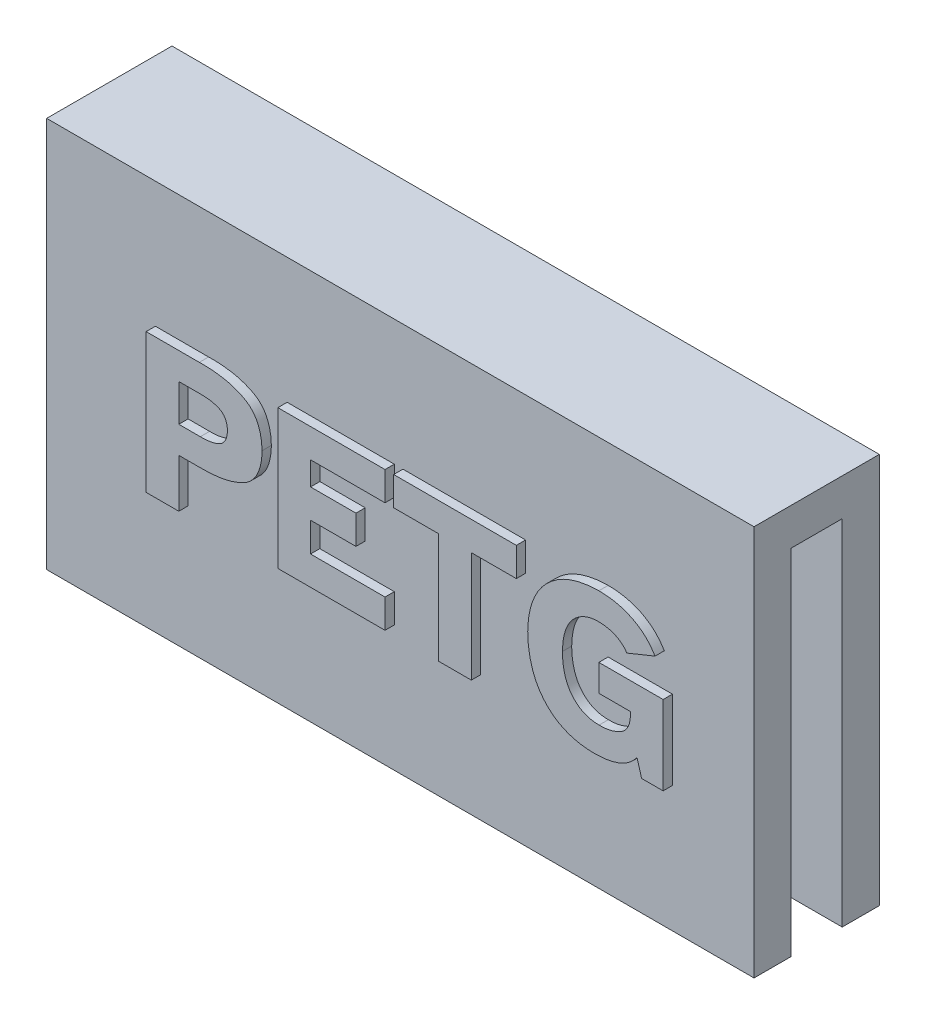
from build123d import *

# Parameters (mm, degrees)
BOSS_EXTRUDE1_DEPTH = 38.1
BOSS_EXTRUDE3_DEPTH = 1


with BuildPart() as part:
    # Sketch1 → Boss-Extrude1 (new, symmetric)
    with BuildSketch(Plane(origin=(0, 0, 0), x_dir=(0, 0, -1), z_dir=(1, 0, 0))):
        Polygon((0, 0), (0, 42.1), (13.5, 42.1), (13.5, 0), (9.5, 0), (9.5, 38.1), (4, 38.1), (4, 0), align=None)
    extrude(amount=BOSS_EXTRUDE1_DEPTH, both=True)

    # Sketch2 → Boss-Extrude3 (add, symmetric)
    # profile 1 of 4: a face of its own
    with BuildSketch(Plane.XY):
        with BuildLine():
            Line((-22.865222246, 13.563040297), (-22.865222246, 18.780432709))
            Line((-22.865222246, 18.780432709), (-20.656196004, 18.780432709))
            add(Edge.make_bspline(
                [(-20.656196004, 18.780432709), (-20.41532138, 18.777714688), (-19.944746821, 18.772404742), (-19.256261279, 18.810224697), (-18.600645479, 18.877020485), (-17.978390446, 18.980226184), (-17.390247833, 19.12055906), (-16.836558282, 19.293424233), (-16.315862603, 19.49892128), (-15.828517725, 19.737297205), (-15.380553204, 20.022617586), (-14.993581031, 20.375797987), (-14.662017368, 20.786709496), (-14.391374272, 21.257071797), (-14.179098793, 21.785516775), (-14.024744286, 22.370402283), (-13.921962582, 23.01285099), (-13.903931965, 23.461547081), (-13.894568167, 23.694567371)],
                knots=[0, 0, 0, 0, 1.204916498, 2.353934341, 3.447552957, 4.50072552, 5.507144687, 6.470335232, 7.400410051, 8.305130608, 9.181490644, 10.047735884, 10.914032333, 11.813195112, 12.752367202, 13.754944245, 14.834080452, 16, 16, 16, 16], degree=3))
            add(Edge.make_bspline(
                [(-13.894568167, 23.694567371), (-13.903912104, 23.925417991), (-13.921898868, 24.369797661), (-14.025029441, 25.006807545), (-14.179399587, 25.587187383), (-14.389513591, 26.111548771), (-14.664177487, 26.574134139), (-14.993451519, 26.981011122), (-15.380818743, 27.330678309), (-15.828590089, 27.612940523), (-16.316667278, 27.84726287), (-16.836506867, 28.053338122), (-17.389829867, 28.226848133), (-17.978554423, 28.363192211), (-18.600944194, 28.462338902), (-19.256226176, 28.530250328), (-19.945228379, 28.567767567), (-20.416269188, 28.562489884), (-20.657613081, 28.559785795)],
                knots=[0, 0, 0, 0, 1.159335541, 2.231681874, 3.232698059, 4.170289135, 5.058653394, 5.923911943, 6.789704034, 7.666336687, 8.571988794, 9.505503644, 10.472256703, 11.481143997, 12.537323696, 13.634987235, 14.788254905, 16, 16, 16, 16], degree=3))
            Line((-20.657613081, 28.559785795), (-26.386965308, 28.563043481))
            Line((-26.386965308, 28.563043481), (-26.386965308, 13.563040297))
            Line((-26.386965308, 13.563040297), (-22.865222246, 13.563040297))
        make_face()
        with BuildLine():
            Line((-22.865222246, 25.667387508), (-20.544629022, 25.667387508))
            add(Edge.make_bspline(
                [(-20.544629022, 25.667387508), (-20.345180429, 25.665639397), (-19.962840192, 25.662288292), (-19.413885258, 25.59887468), (-18.918181922, 25.479214253), (-18.542791264, 25.333863497), (-18.279322093, 25.181576921), (-18.109546209, 25.041861769), (-17.964935401, 24.876369042), (-17.843038449, 24.687071269), (-17.752852301, 24.470987064), (-17.684339378, 24.233628804), (-17.637945851, 23.972355884), (-17.629418881, 23.789333614), (-17.625003742, 23.694567371)],
                knots=[0, 0, 0, 0, 1.781037572, 3.414224772, 4.923837313, 6.326680743, 6.992801752, 7.634335185, 8.281065082, 8.949094245, 9.636325156, 10.36458847, 11.153207937, 12, 12, 12, 12], degree=3))
            add(Edge.make_bspline(
                [(-17.625003742, 23.694567371), (-17.629329654, 23.597614693), (-17.637641958, 23.411318694), (-17.684922478, 23.144843592), (-17.752207557, 22.902812702), (-17.843064613, 22.682637579), (-17.964858791, 22.490072062), (-18.109429188, 22.321339009), (-18.279109983, 22.1782603), (-18.542470117, 22.021767063), (-18.917168662, 21.869595463), (-19.414049866, 21.749447311), (-19.962950296, 21.674835955), (-20.346487469, 21.675658964), (-20.546743492, 21.676088682)],
                knots=[0, 0, 0, 0, 0.858904102, 1.650396881, 2.391060107, 3.081381858, 3.751946835, 4.400513148, 5.042831016, 5.70833034, 7.106722173, 8.605996457, 10.227891054, 12, 12, 12, 12], degree=3))
            Line((-20.546743492, 21.676088682), (-22.865222246, 21.676088682))
            Line((-22.865222246, 21.676088682), (-22.865222246, 25.667387508))
        make_face(mode=Mode.SUBTRACT)
    # profile 2 of 4: a face of its own
    with BuildSketch(Plane.XY):
        Polygon((-12.195657947, 13.563043481), (-0.649855777, 13.563043481), (-0.649855777, 16.667391966), (-8.673914885, 16.667391966), (-8.673914885, 19.823911191), (-3.782845148, 19.823911191), (-3.782845148, 22.928262861), (-8.673914885, 22.928262861), (-8.673914885, 25.458691811), (-0.649855777, 25.458691811), (-0.649855777, 28.563043481), (-12.195657947, 28.563043481), align=None)
    # profile 3 of 4: a face of its own
    with BuildSketch(Plane.XY):
        Polygon((5.12608486, 25.458691811), (5.12608486, 13.563040297), (8.647827923, 13.563040297), (8.647827923, 25.458691811), (13.493818677, 25.458691811), (13.493818677, 28.563043481), (0.280094107, 28.563043481), (0.280094107, 25.458691811), align=None)
    # profile 4 of 4: a face of its own
    with BuildSketch(Plane.XY):
        with BuildLine():
            add(Edge.make_bspline(
                [(21.8608551, 13.354347785), (22.119813105, 13.358336117), (22.621956763, 13.366069866), (23.347309068, 13.45445267), (24.017283661, 13.603578733), (24.630497021, 13.811632782), (25.189445256, 14.078118279), (25.684655597, 14.415907315), (26.129733363, 14.807635649), (26.374895594, 15.114568002), (26.497831712, 15.268478626)],
                knots=[0, 0, 0, 0, 1.191138677, 2.309728683, 3.355722582, 4.344328933, 5.283888983, 6.195335572, 7.095054579, 8, 8, 8, 8], degree=3))
            Line((26.497831712, 15.268478626), (26.990503352, 13.563040297))
            Line((26.990503352, 13.563040297), (29.30869869, 13.563040297))
            Line((29.30869869, 13.563040297), (29.30869869, 22.088177976))
            Line((29.30869869, 22.088177976), (22.382852281, 22.088177976))
            Line((22.382852281, 22.088177976), (22.382852281, 19.203123016))
            Line((22.382852281, 19.203123016), (25.786955627, 19.203123016))
            Line((25.786955627, 19.203123016), (25.786955627, 18.774812166))
            add(Edge.make_bspline(
                [(25.786955627, 18.774812166), (25.778243203, 18.661219148), (25.761488992, 18.442776904), (25.702246402, 18.128562143), (25.614895527, 17.840434035), (25.497809633, 17.575930668), (25.346821564, 17.340790726), (25.16732423, 17.130707606), (24.957475692, 16.947308094), (24.63654282, 16.740507442), (24.194902065, 16.536753638), (23.629652259, 16.364249197), (23.028988663, 16.258629639), (22.6167514, 16.25292484), (22.405439539, 16.250000573)],
                knots=[0, 0, 0, 0, 0.861669082, 1.657011429, 2.414175731, 3.135788245, 3.838590194, 4.52112295, 5.220643916, 5.939296776, 7.403767205, 8.884228686, 10.402862886, 12, 12, 12, 12], degree=3))
            add(Edge.make_bspline(
                [(22.405439539, 16.250000573), (22.25960337, 16.255002366), (21.974358066, 16.26478552), (21.556473033, 16.323383598), (21.161578461, 16.4238954), (20.790499519, 16.565804834), (20.441850175, 16.742306557), (20.115717207, 16.958951958), (19.816347235, 17.219006913), (19.537082003, 17.513572772), (19.286190745, 17.845177479), (19.070603452, 18.215328788), (18.883726471, 18.617755475), (18.732087018, 19.05621736), (18.609948745, 19.528105564), (18.528810433, 20.035948609), (18.471242635, 20.57699171), (18.461518922, 20.949842028), (18.456525657, 21.141305959)],
                knots=[0, 0, 0, 0, 0.986869521, 1.930247473, 2.848904307, 3.738120068, 4.613047601, 5.488129678, 6.379987628, 7.290452962, 8.230384354, 9.186491415, 10.18353076, 11.227919754, 12.321393683, 13.477294155, 14.704554734, 16, 16, 16, 16], degree=3))
            add(Edge.make_bspline(
                [(18.456525657, 21.141305959), (18.462691715, 21.33059976), (18.47469819, 21.699190413), (18.534060968, 22.233041601), (18.62284679, 22.732163005), (18.751930806, 23.192563277), (18.905705346, 23.620561964), (19.100451259, 24.00895419), (19.321125945, 24.36633998), (19.58108987, 24.680617067), (19.860542252, 24.962795133), (20.162806955, 25.204508316), (20.481013939, 25.412390421), (20.817605993, 25.582469386), (21.172019795, 25.713956508), (21.544172891, 25.804526785), (21.934117354, 25.861522595), (22.200891059, 25.869009794), (22.336961264, 25.872828703)],
                knots=[0, 0, 0, 0, 1.319686362, 2.569677693, 3.740666748, 4.849050422, 5.89897666, 6.905298387, 7.872232364, 8.820039799, 9.741499591, 10.636028391, 11.512339942, 12.386520023, 13.259089862, 14.141114384, 15.051859528, 16, 16, 16, 16], degree=3))
            add(Edge.make_bspline(
                [(22.336961264, 25.872828703), (22.524294222, 25.867412582), (22.883466683, 25.857028283), (23.394731341, 25.772727742), (23.856558075, 25.649553589), (24.263315352, 25.470493213), (24.620629848, 25.258577476), (24.928723783, 25.018120229), (25.195978892, 24.759746675), (25.332326749, 24.561134201), (25.398918436, 24.464132752)],
                knots=[0, 0, 0, 0, 1.278335478, 2.450945646, 3.529594048, 4.533408079, 5.47533349, 6.35867971, 7.198386473, 8, 8, 8, 8], degree=3))
            Line((25.398918436, 24.464132752), (28.439218206, 25.700050346))
            add(Edge.make_bspline(
                [(28.439218206, 25.700050346), (28.361079034, 25.823929698), (28.206257037, 26.069379557), (27.948215698, 26.41541292), (27.668439938, 26.7372298), (27.369948167, 27.03715345), (27.048315584, 27.311527509), (26.708040547, 27.564420909), (26.345403709, 27.791997061), (25.963035389, 27.997909002), (25.564035608, 28.179099544), (25.150089409, 28.336749678), (24.722958781, 28.469607783), (24.281431216, 28.581812576), (23.825986668, 28.665722756), (23.3566313, 28.723737703), (22.874502715, 28.760511724), (22.547897044, 28.765803507), (22.382613447, 28.768481492)],
                knots=[0, 0, 0, 0, 0.987447504, 1.956491095, 2.907400243, 3.861102247, 4.807224743, 5.755757746, 6.717677965, 7.691726565, 8.682375344, 9.670716339, 10.676890986, 11.697355627, 12.741116498, 13.797592121, 14.885439147, 16, 16, 16, 16], degree=3))
            add(Edge.make_bspline(
                [(22.382613447, 28.768481492), (22.099730981, 28.758621488), (21.546339814, 28.739332773), (20.738378686, 28.639019262), (19.976200826, 28.471654692), (19.256240644, 28.248028091), (18.582018051, 27.956846547), (17.953235542, 27.602814057), (17.366836258, 27.189513377), (16.831285034, 26.712718675), (16.342994106, 26.186120845), (15.920267276, 25.60388094), (15.560854464, 24.974654528), (15.262488717, 24.299715759), (15.031227955, 23.576774675), (14.863080191, 22.807064787), (14.753855008, 21.989948886), (14.733332745, 21.428607179), (14.722829213, 21.141305959)],
                knots=[0, 0, 0, 0, 1.115331854, 2.181877176, 3.203772788, 4.187522244, 5.148954065, 6.092764476, 7.027114261, 7.971051081, 8.914054022, 9.852422535, 10.800463299, 11.765325617, 12.755760334, 13.786945325, 14.86733286, 16, 16, 16, 16], degree=3))
            add(Edge.make_bspline(
                [(14.722829213, 21.141305959), (14.730391549, 20.847575412), (14.745163979, 20.273795857), (14.84038858, 19.438408616), (14.994067089, 18.651412225), (15.200032703, 17.912316957), (15.469382319, 17.22226235), (15.794902903, 16.581399506), (16.179745575, 15.988990666), (16.61978942, 15.447409763), (17.111798353, 14.960441635), (17.653299929, 14.536564006), (18.241912503, 14.179583732), (18.876009186, 13.884113096), (19.55662642, 13.654005492), (20.282457402, 13.483895793), (21.054564416, 13.378322793), (21.585535664, 13.362470658), (21.857613336, 13.354347785)],
                knots=[0, 0, 0, 0, 1.181046208, 2.307081006, 3.375954413, 4.402557026, 5.387877309, 6.349572523, 7.287872367, 8.223031757, 9.150200772, 10.065592574, 10.981568491, 11.912305234, 12.87289741, 13.865182061, 14.906087104, 16, 16, 16, 16], degree=3))
            Line((21.857613336, 13.354347785), (21.8608551, 13.354347785))
        make_face()
    extrude(amount=BOSS_EXTRUDE3_DEPTH, both=True)


solid = part.part
